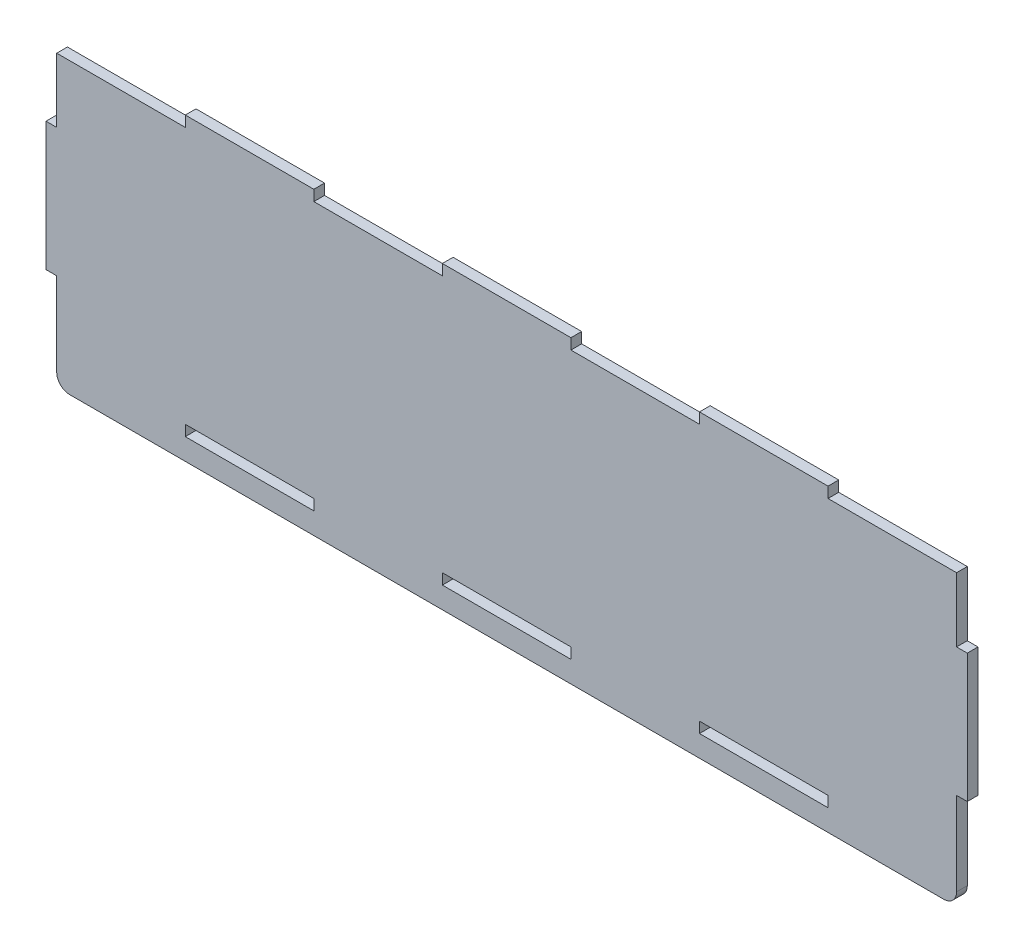
from build123d import *

# Parameters (mm, degrees)
SKETCH1_W           = 30
SKETCH1_H           = 2.5
BOSS_EXTRUDE1_DEPTH = 1.25
FILLET1_R           = 3


with BuildPart() as part:
    # Sketch1 → Boss-Extrude1 (new, symmetric)
    with BuildSketch(Plane.XY):
        Polygon((-105, -37.5), (-105, -30), (-105, -15), (-107.5, -15), (-107.5, 15), (-105, 15), (-105, 30), (-75, 30), (-75, 32.5), (-45, 32.5), (-45, 30), (-15, 30), (-15, 32.5), (15, 32.5), (15, 30), (45, 30), (45, 32.5), (75, 32.5), (75, 30), (105, 30), (105, 15), (107.5, 15), (107.5, -15), (105, -15), (105, -30), (105, -37.5), align=None)
        with Locations((-60, -31.25)):
            Rectangle(SKETCH1_W, SKETCH1_H, mode=Mode.SUBTRACT)
        with Locations((0, -31.25)):
            Rectangle(SKETCH1_W, SKETCH1_H, mode=Mode.SUBTRACT)
        with Locations((60, -31.25)):
            Rectangle(SKETCH1_W, SKETCH1_H, mode=Mode.SUBTRACT)
    extrude(amount=BOSS_EXTRUDE1_DEPTH, both=True)

    # Fillet1
    fillet1_edges = [part.edges().sort_by_distance(p)[0] for p in [
        (105, -37.5, 0),
        (-105, -37.5, 0),
    ]]
    fillet(fillet1_edges, radius=FILLET1_R)


solid = part.part
